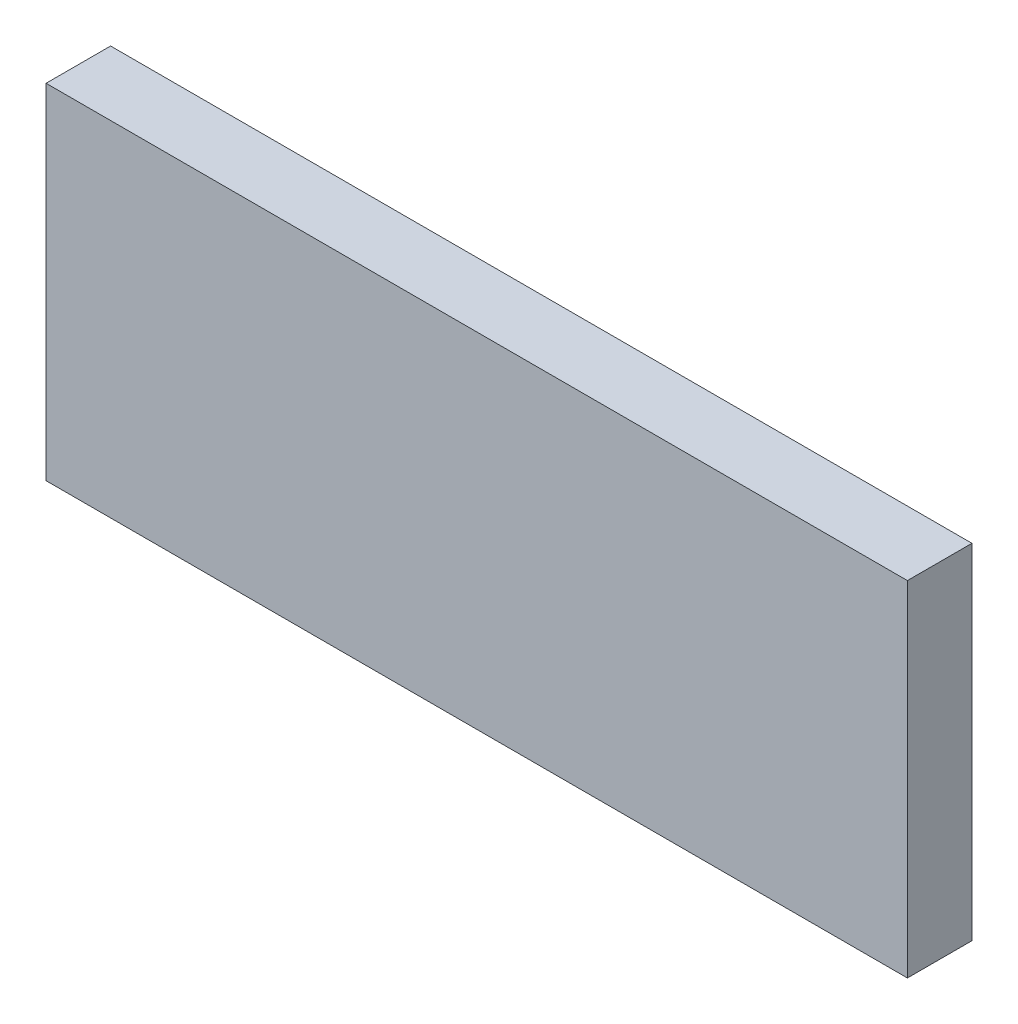
from build123d import *

# Parameters (mm, degrees)
CROQUIS1_W              = 15
CROQUIS1_H              = 80
SALIENTE_EXTRUIR1_DEPTH = 200.2


with BuildPart() as part:
    # Croquis1 → Saliente-Extruir1 (new body)
    with BuildSketch(Plane(origin=(0, 0, 0), x_dir=(0, 0, -1), z_dir=(1, 0, 0))):
        Rectangle(CROQUIS1_W, CROQUIS1_H)
    extrude(amount=SALIENTE_EXTRUIR1_DEPTH)


solid = part.part
